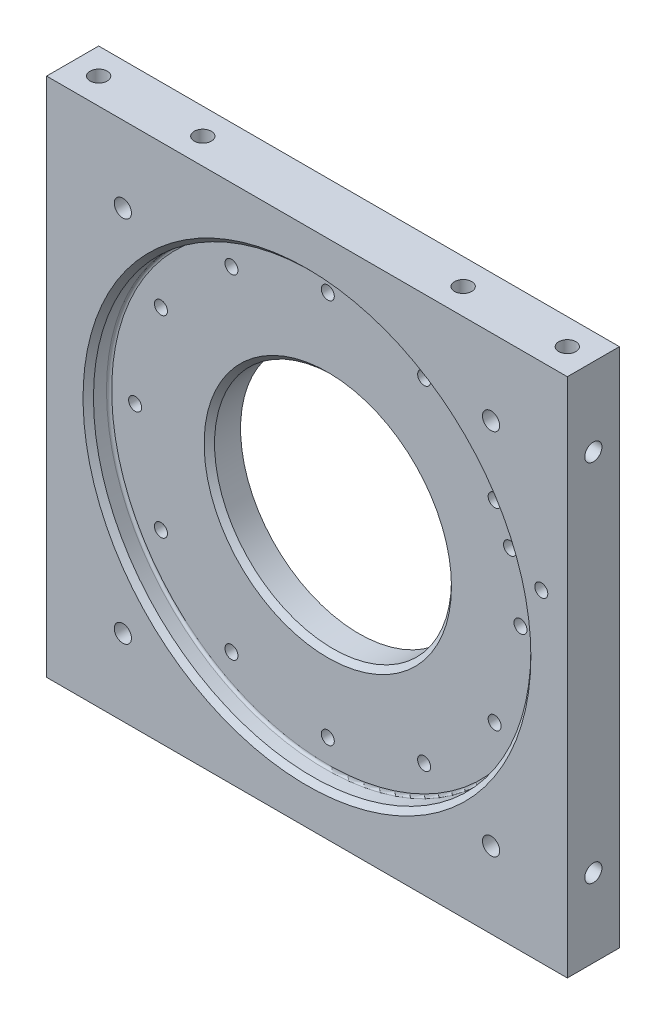
from build123d import *

# Parameters (mm, degrees)
SKETCH1_W             = 10
SKETCH1_H             = 100
BOSS_EXTRUDE1_DEPTH   = 50
SKETCH2_R             = 42
CUT_EXTRUDE1_DEPTH    = 4
CUT_EXTRUDE3_REACH    = 72.965
SKETCH4_R             = 22.75
M3_TAPPED_HOLE1_D     = 2.5
FILLET3_R             = 0.5
CHAMFER1_SIZE         = 1
M4_TAPPED_HOLE1_D     = 3.3
M4_TAPPED_HOLE1_DEPTH = 11
M4_TAPPED_HOLE1_TIP   = 0.991420021
M4_TAPPED_HOLE2_D     = 3.3
M4_TAPPED_HOLE2_DEPTH = 11
M4_TAPPED_HOLE2_TIP   = 0.991420021
M4_TAPPED_HOLE3_D     = 3.3
M4_TAPPED_HOLE3_DEPTH = 11
M4_TAPPED_HOLE3_TIP   = 0.991420021
M4_TAPPED_HOLE4_D     = 3.3
M4_TAPPED_HOLE4_DEPTH = 11
M4_TAPPED_HOLE4_TIP   = 0.991420021
M4_TAPPED_HOLE5_D     = 3.3


with BuildPart() as part:
    # Sketch1 → Boss-Extrude1 (new, symmetric)
    with BuildSketch(Plane(origin=(0, 0, 0), x_dir=(0, 0, -1), z_dir=(1, 0, 0))):
        Rectangle(SKETCH1_W, SKETCH1_H)
    extrude(amount=BOSS_EXTRUDE1_DEPTH, both=True)

    # Sketch2 → Cut-Extrude1 (cut)
    with BuildSketch(Plane.XY.offset(5)):
        Circle(SKETCH2_R)
    extrude(amount=-CUT_EXTRUDE1_DEPTH, mode=Mode.SUBTRACT)

    # Sketch4 → Cut-Extrude3 (cut, up to next)
    with BuildSketch(Plane.XY.offset(1), mode=Mode.PRIVATE) as cut_extrude3_sk1:
        Circle(SKETCH4_R)
    cut_extrude3_tool1 = extrude(cut_extrude3_sk1.sketch, amount=-CUT_EXTRUDE3_REACH, mode=Mode.PRIVATE) & part.part
    add(cut_extrude3_tool1.solids().sort_by_distance((0, 0, 1))[0], mode=Mode.SUBTRACT)

    # M3 Tapped Hole1 (through all)
    with Locations(Plane(origin=(0, 0, -5), x_dir=(1, 0, 0), z_dir=(0, 0, -1))):
        with Locations((35, -12), (-37, 0), (37, 0), (18.5, -32.04293994), (-32.04293994, -18.5), (32.04293994, 18.5), (-18.5, 32.04293994), (0, -37), (0, 37), (-18.5, -32.04293994), (18.5, 32.04293994), (32.04293994, -18.5), (-32.04293994, 18.5), (45, -12)):
            Hole(M3_TAPPED_HOLE1_D / 2)

    # Fillet3
    fillet3_edges = [part.edges().sort_by_distance(p)[0] for p in [
        (-42, 0, 1),
    ]]
    fillet(fillet3_edges, radius=FILLET3_R)

    # Chamfer1
    chamfer1_edges = [part.edges().sort_by_distance(p)[0] for p in [
        (-42, 0, 5),
        (-22.75, 0, 1),
    ]]
    chamfer(chamfer1_edges, length=CHAMFER1_SIZE)

    # M4 Tapped Hole1
    with Locations(Plane(origin=(0, 50, 0), x_dir=(1, 0, 0), z_dir=(0, 1, 0))):
        with Locations((-45, 0), (-25, 0), (25, 0), (45, 0)):
            Hole(M4_TAPPED_HOLE1_D / 2, depth=M4_TAPPED_HOLE1_DEPTH)
            with Locations((0, 0, -(M4_TAPPED_HOLE1_DEPTH + M4_TAPPED_HOLE1_TIP / 2))):  # 118° drill point
                Cone(0, M4_TAPPED_HOLE1_D / 2, M4_TAPPED_HOLE1_TIP, mode=Mode.SUBTRACT)

    # M4 Tapped Hole2
    with Locations(Plane(origin=(0, -50, 0), x_dir=(-1, 0, 0), z_dir=(0, -1, 0))):
        with Locations((45, 0), (25, 0), (-25, 0), (-45, 0)):
            Hole(M4_TAPPED_HOLE2_D / 2, depth=M4_TAPPED_HOLE2_DEPTH)
            with Locations((0, 0, -(M4_TAPPED_HOLE2_DEPTH + M4_TAPPED_HOLE2_TIP / 2))):  # 118° drill point
                Cone(0, M4_TAPPED_HOLE2_D / 2, M4_TAPPED_HOLE2_TIP, mode=Mode.SUBTRACT)

    # M4 Tapped Hole3
    with Locations(Plane(origin=(50, 0, 0), x_dir=(0, 0, -1), z_dir=(1, 0, 0))):
        with Locations((0, 35), (0, -35)):
            Hole(M4_TAPPED_HOLE3_D / 2, depth=M4_TAPPED_HOLE3_DEPTH)
            with Locations((0, 0, -(M4_TAPPED_HOLE3_DEPTH + M4_TAPPED_HOLE3_TIP / 2))):  # 118° drill point
                Cone(0, M4_TAPPED_HOLE3_D / 2, M4_TAPPED_HOLE3_TIP, mode=Mode.SUBTRACT)

    # M4 Tapped Hole4
    with Locations(Plane.ZY.offset(50)):
        with Locations((0, 35), (0, -35)):
            Hole(M4_TAPPED_HOLE4_D / 2, depth=M4_TAPPED_HOLE4_DEPTH)
            with Locations((0, 0, -(M4_TAPPED_HOLE4_DEPTH + M4_TAPPED_HOLE4_TIP / 2))):  # 118° drill point
                Cone(0, M4_TAPPED_HOLE4_D / 2, M4_TAPPED_HOLE4_TIP, mode=Mode.SUBTRACT)

    # M4 Tapped Hole5 (through all)
    with Locations(Plane.XY.offset(5)):
        with Locations((-35.355339059, 35.355339059), (35.355339059, -35.355339059), (35.355339059, 35.355339059), (-35.355339059, -35.355339059)):
            Hole(M4_TAPPED_HOLE5_D / 2)


solid = part.part
